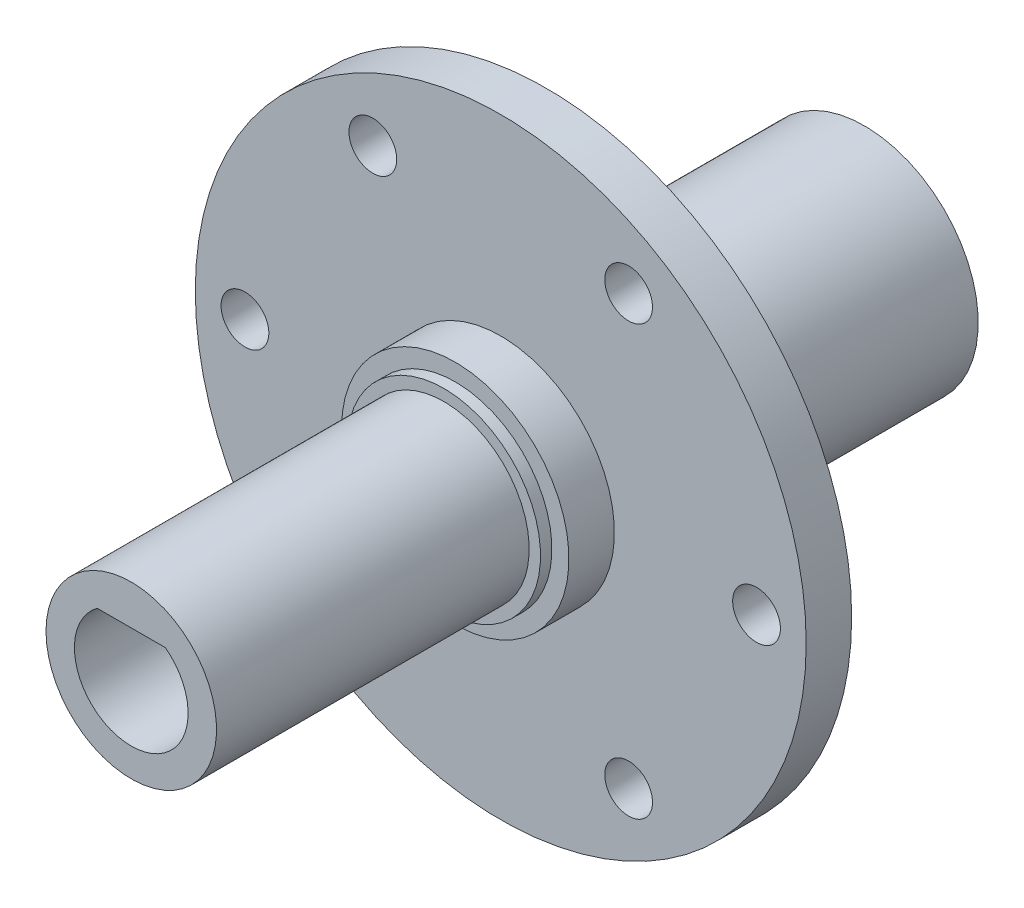
from build123d import *

# Parameters (mm, degrees)
CUT_EXTRUDE_1_DEPTH = 13.4
SKETCH_4_R          = 2.1
CUT_EXTRUDE_2_DEPTH = 13.4


with BuildPart() as part:
    # 草图2 → 旋转1 (revolve)
    with BuildSketch(Plane(origin=(0, 0, 0), x_dir=(1, 0, 0), z_dir=(0, 1, 0))):
        Polygon((-21.742218247, 43.984257603), (-18.742218247, 43.984257603), (-18.742218247, 23.034257603), (-11.742218247, 18.979304476), (-11.742218247, -20.515742397), (-19.242218247, -20.515742397), (-19.242218247, 6.984257603), (-20.242218247, 6.984257603), (-20.242218247, 7.984257603), (-21.742218247, 7.984257603), (-21.742218247, 11.984257603), (-38.612218247, 11.984257603), (-38.612218247, 15.984257603), (-21.742218247, 15.984257603), align=None)
    revolve(axis=Axis((-11.742218247, 0, -18.979304476), (0, 0, 1)))

    # 草图3 → 切除-拉伸1 (cut)
    with BuildSketch(Plane.XY.offset(20.515742397)):
        with BuildLine():
            Line((-11.742218247, 4), (-14.742218247, 4))
            ThreePointArc((-14.742218247, 4), (-11.742218247, -5), (-8.742218247, 4))
            Line((-8.742218247, 4), (-11.742218247, 4))
        make_face()
    extrude(amount=-CUT_EXTRUDE_1_DEPTH, mode=Mode.SUBTRACT)

    # 草图4 → 切除-拉伸2 (cut)
    with BuildSketch(Plane.XY.offset(-11.984257603)):
        with Locations((-0.492218247, -18.86)):
            Circle(SKETCH_4_R)
        with Locations((10.757781753, 0)):
            Circle(SKETCH_4_R)
        with Locations(Location((-22.992218247, -18.86, 0), (0, 0, 180))):
            Circle(SKETCH_4_R)
        with Locations(Location((-34.242218247, 0, 0), (0, 0, 180))):
            Circle(SKETCH_4_R)
        with Locations((-22.992218247, 18.86)):
            Circle(SKETCH_4_R)
        with Locations(Location((-0.492218247, 18.86, 0), (0, 0, 180))):
            Circle(SKETCH_4_R)
    extrude(amount=-CUT_EXTRUDE_2_DEPTH, mode=Mode.SUBTRACT)


solid = part.part
